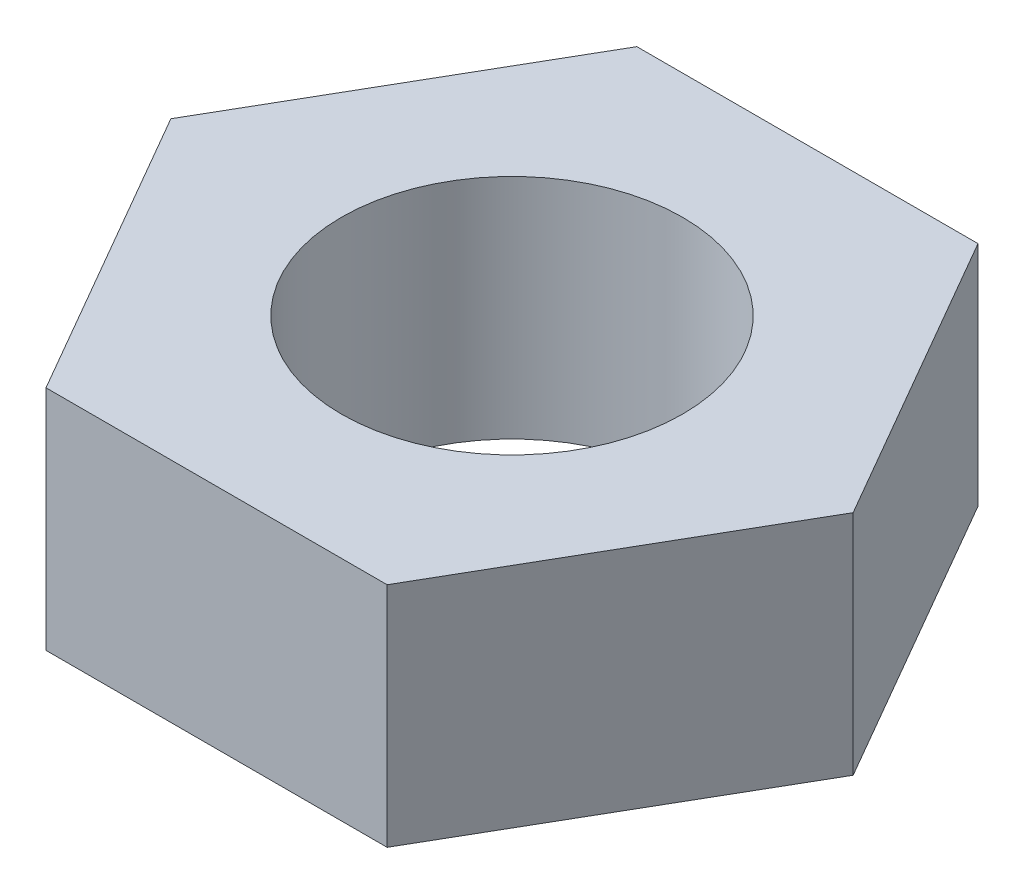
from build123d import *

# Parameters (mm, degrees)
SKETCH1_R           = 1.5
BOSS_EXTRUDE1_DEPTH = 2


with BuildPart() as part:
    # Sketch1 → Boss-Extrude1 (new body)
    with BuildSketch(Plane(origin=(0, 0, 0), x_dir=(1, 0, 0), z_dir=(0, 1, 0))):
        Polygon((-3, 0), (-1.5, 2.598076211), (1.5, 2.598076211), (3, 0), (1.5, -2.598076211), (-1.5, -2.598076211), align=None)
        with Locations(Location((0, 0, 0), (0, 0, 270))):
            Circle(SKETCH1_R, mode=Mode.SUBTRACT)
    extrude(amount=BOSS_EXTRUDE1_DEPTH)


solid = part.part
